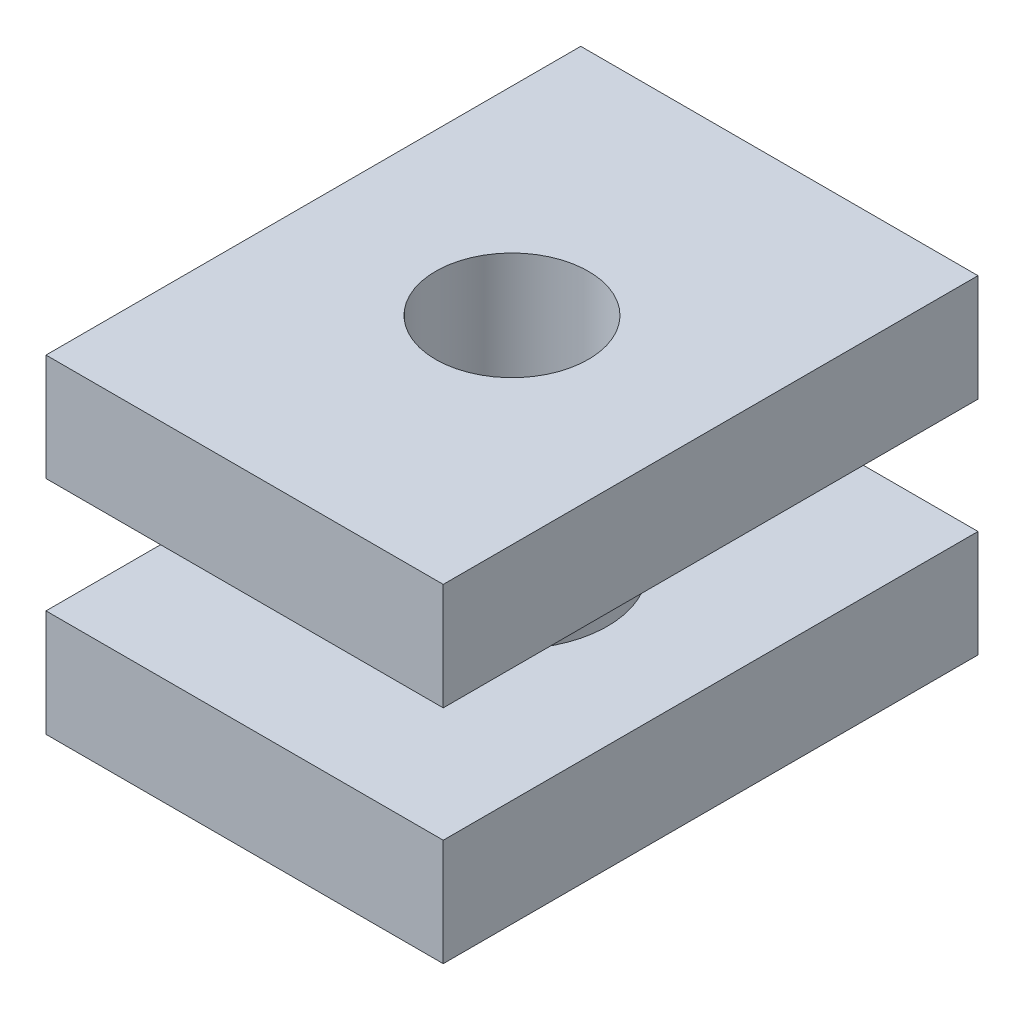
from build123d import *

# Parameters (mm, degrees)
SKETCH3_R           = 1.5875
BOSS_EXTRUDE2_DEPTH = 2.7305
SKETCH4_W           = 6.604
SKETCH4_H           = 8.89
BOSS_EXTRUDE3_DEPTH = 1.778
SKETCH5_W           = 6.604
SKETCH5_H           = 8.89
BOSS_EXTRUDE4_DEPTH = 1.778
SKETCH6_R           = 1.27
CUT_EXTRUDE1_DEPTH  = 8.777129933


with BuildPart() as part:
    # Sketch3 → Boss-Extrude2 (new, symmetric)
    with BuildSketch(Plane(origin=(0, 0, 0), x_dir=(1, 0, 0), z_dir=(0, 1, 0))):
        with Locations(Location((0, 0, 0), (0, 0, 270))):
            Circle(SKETCH3_R)
    extrude(amount=BOSS_EXTRUDE2_DEPTH, both=True)

    # Sketch4 → Boss-Extrude3 (add)
    with BuildSketch(Plane.XZ.offset(2.7305)):
        Rectangle(SKETCH4_W, SKETCH4_H)
    extrude(amount=-BOSS_EXTRUDE3_DEPTH)

    # Sketch5 → Boss-Extrude4 (add)
    with BuildSketch(Plane(origin=(0, 2.7305, 0), x_dir=(1, 0, 0), z_dir=(0, 1, 0))):
        Rectangle(SKETCH5_W, SKETCH5_H)
    extrude(amount=-BOSS_EXTRUDE4_DEPTH)

    # Sketch6 → Cut-Extrude1 (cut, through all)
    with BuildSketch(Plane(origin=(0, 2.7305, 0), x_dir=(1, 0, 0), z_dir=(0, 1, 0))):
        with Locations(Location((0, 0, 0), (0, 0, 270))):
            Circle(SKETCH6_R)
    extrude(amount=-CUT_EXTRUDE1_DEPTH, mode=Mode.SUBTRACT)


solid = part.part
